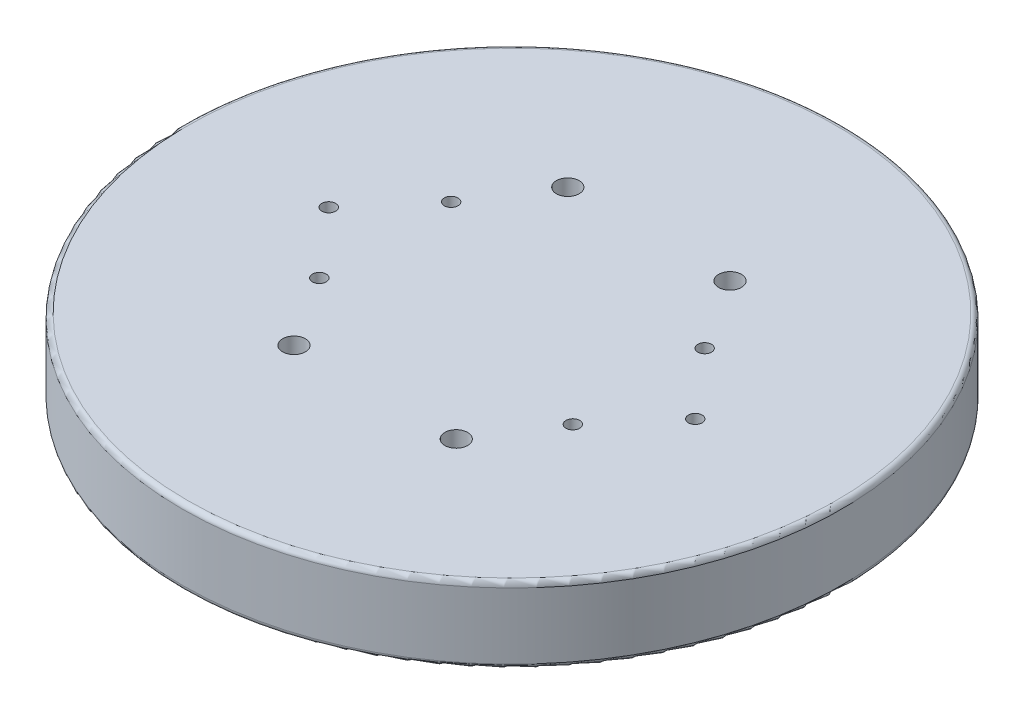
from build123d import *

# Parameters (mm, degrees)
SKETCH1_R             = 65
BOSS_EXTRUDE1_DEPTH   = 15
FILLET1_R             = 1
F_6_32_TAPPED_HOLE1_D = 2.7051
F_8_CLEARANCE_HOLE1_D = 4.4958


with BuildPart() as part:
    # Sketch1 → Boss-Extrude1 (new body)
    with BuildSketch(Plane(origin=(0, 0, 0), x_dir=(1, 0, 0), z_dir=(0, 1, 0))):
        with Locations(Location((0, 0, 0), (0, 0, 270))):
            Circle(SKETCH1_R)
    extrude(amount=BOSS_EXTRUDE1_DEPTH)

    # Fillet1
    fillet1_edges = [part.edges().sort_by_distance(p)[0] for p in [
        (0, 0, -65),
        (0, 15, -65),
    ]]
    fillet(fillet1_edges, radius=FILLET1_R)

    # #6-32 Tapped Hole1 (through all)
    with Locations(Plane.XZ):
        with Locations((-36.145, 0), (36.145, 0), (-25, -13), (-25, 13), (25, 13), (25, -13)):
            Hole(F_6_32_TAPPED_HOLE1_D / 2)

    # #8 Clearance Hole1 (through all)
    with Locations(Plane(origin=(0, 0, 0), x_dir=(-1, 0, 0), z_dir=(0, -1, 0))):
        with Locations((16, -27), (-16, -27), (16, 27), (-16, 27)):
            Hole(F_8_CLEARANCE_HOLE1_D / 2)


solid = part.part
